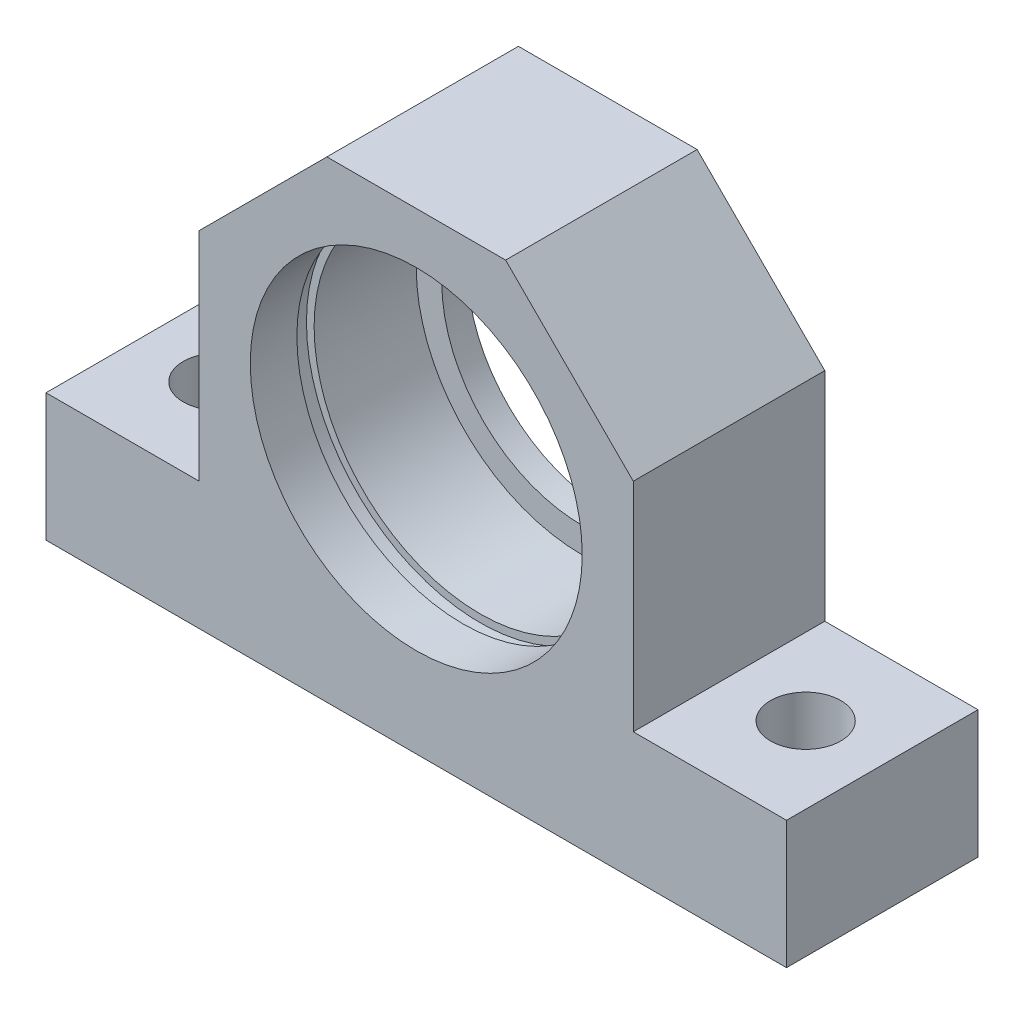
from build123d import *

# Parameters (mm, degrees)
BOSS_EXTRUDE1_DEPTH = 15
DIAMETER_HOLE1_D    = 5.5
CHAMFER1_SIZE       = 10


with BuildPart() as part:
    # Sketch1 → Boss-Extrude1 (new body)
    with BuildSketch(Plane.XY):
        Polygon((-17, 37), (17, 37), (17, 10), (29, 10), (29, 0), (-29, 0), (-29, 10), (-17, 10), align=None)
    extrude(amount=-BOSS_EXTRUDE1_DEPTH)

    # Sketch2 → Cut-Revolve1 (revolve, cut)
    with BuildSketch(Plane(origin=(0, 0, 0), x_dir=(0, 0, -1), z_dir=(1, 0, 0))):
        Polygon((3.65, 33), (3.65, 33.6), (5, 33.6), (5, 33), (13, 33), (13, 31), (15, 31), (15, 20), (0, 20), (0, 33), align=None)
    revolve(axis=Axis((0, 20, -15), (0, 0, 1)), mode=Mode.SUBTRACT)

    # Diameter Hole1 (through all)
    with Locations(Plane(origin=(0, 10, 0), x_dir=(1, 0, 0), z_dir=(0, 1, 0))):
        with Locations((-23, 7.5), (23, 7.5)):
            Hole(DIAMETER_HOLE1_D / 2)

    # Chamfer1
    chamfer1_edges = [part.edges().sort_by_distance(p)[0] for p in [
        (-17, 37, -7.5),
        (17, 37, -7.5),
    ]]
    chamfer(chamfer1_edges, length=CHAMFER1_SIZE)


solid = part.part
